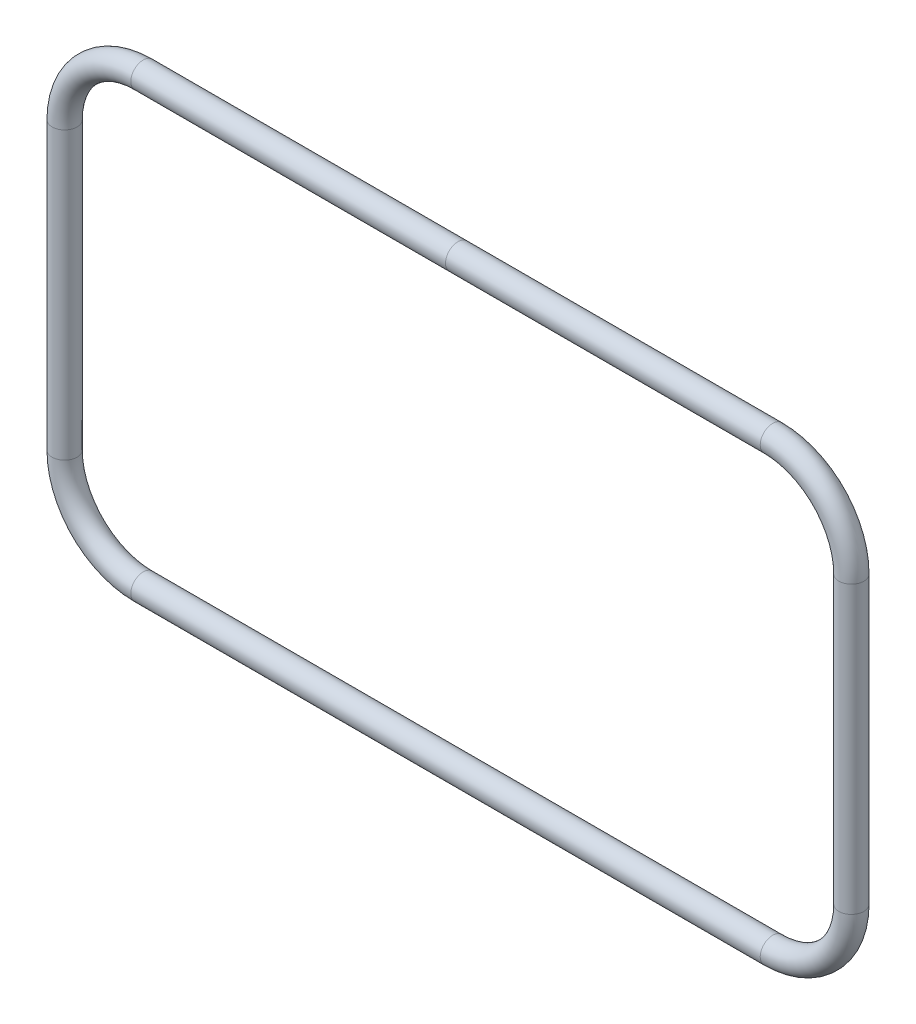
from build123d import *

# Parameters (mm, degrees)
ESBO_O2_R = 4.7625


with BuildPart() as part:
    # Varredura1: sweep along a path in Esboço1
    with BuildLine(Plane.XY) as varredura1_path:
        Line((120, -84.525), (-120, -84.525))
        ThreePointArc((-120, -84.525), (-141.213203436, -75.738203436), (-150, -54.525))
        Line((-150, -54.525), (-150, 54.525))
        ThreePointArc((-150, 54.525), (-141.213203436, 75.738203436), (-120, 84.525))
        Line((-120, 84.525), (120, 84.525))
        ThreePointArc((120, 84.525), (141.213203436, 75.738203436), (150, 54.525))
        Line((150, 54.525), (150, -54.525))
        ThreePointArc((150, -54.525), (141.213203436, -75.738203436), (120, -84.525))
    # Esboço2 → Varredura1 (sweep)
    with BuildSketch(Plane(origin=(0, 0, 0), x_dir=(0, 0, -1), z_dir=(1, 0, 0))):
        with Locations((0, 84.525)):
            Circle(ESBO_O2_R)
    sweep(path=varredura1_path.line)


solid = part.part
